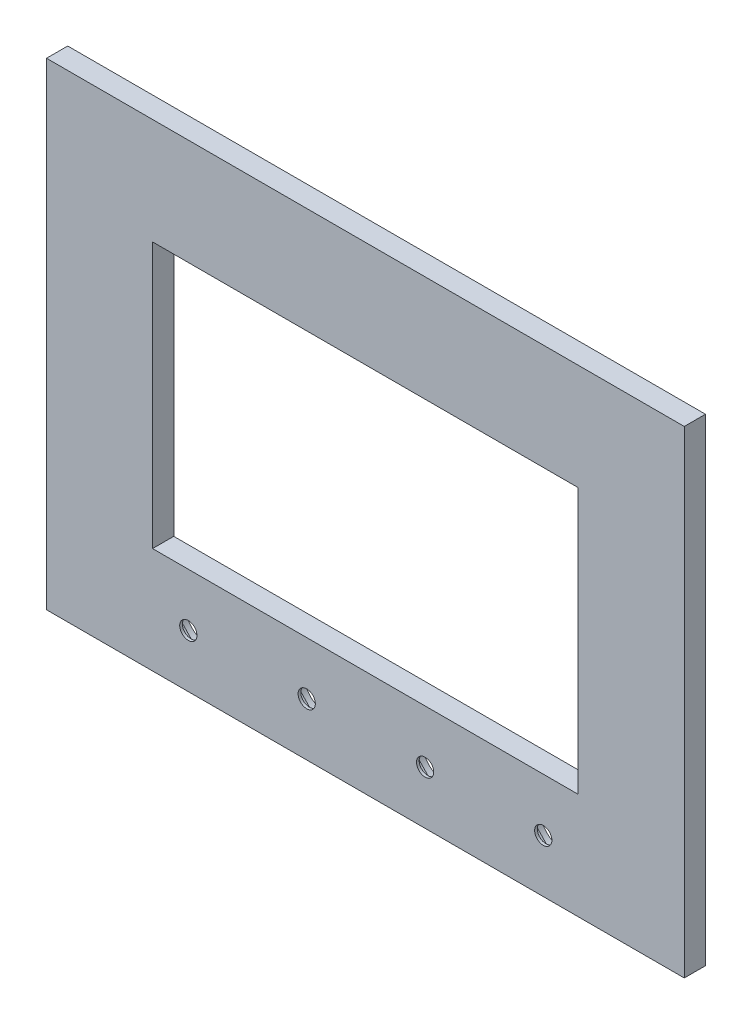
from build123d import *

# Parameters (mm, degrees)
SKETCH1_W                      = 240.6
SKETCH1_H                      = 180.2
BOSS_EXTRUDE1_DEPTH            = 8
SKETCH2_W                      = 160.6
SKETCH2_H                      = 100.2
CUT_EXTRUDE1_DEPTH             = 200.503872501
CUT_EXTRUDE2_DEPTH             = 7
CUT_EXTRUDE3_DEPTH             = 7
CUT_EXTRUDE4_DEPTH             = 7
CUT_EXTRUDE5_DEPTH             = 7
F_6_5_6_5_DIAMETER_HOLE1_D     = 6.5
F_6_5_6_5_DIAMETER_HOLE1_DEPTH = 8
SKETCH9_R                      = 9.267416037
SKETCH9_R_2                    = 9.269178346
SKETCH9_R_3                    = 9.266671768
CUT_EXTRUDE7_DEPTH             = 4


with BuildPart() as part:
    # Sketch1 → Boss-Extrude1 (new body)
    with BuildSketch(Plane(origin=(0, 0, 0), x_dir=(-1, 0, 0), z_dir=(0, 0, -1))):
        with Locations((-50.702318109, 12.34999924)):
            Rectangle(SKETCH1_W, SKETCH1_H)
    extrude(amount=-BOSS_EXTRUDE1_DEPTH)

    # Sketch2 → Cut-Extrude1 (cut, through all)
    with BuildSketch(Plane.XY.offset(8)):
        with Locations((50.702318109, 12.34999924)):
            Rectangle(SKETCH2_W, SKETCH2_H)
    extrude(amount=-CUT_EXTRUDE1_DEPTH, mode=Mode.SUBTRACT)

    # Sketch3 → Cut-Extrude2 (cut)
    with BuildSketch(Plane(origin=(0, 0, 0), x_dir=(-1, 0, 0), z_dir=(0, 0, -1))):
        Polygon((-117.686768689, -48.483328992), (-127.060792146, -58.198146757), (-117.921667286, -67.016672528), (-108.547643828, -57.301854763), align=None)
    extrude(amount=-CUT_EXTRUDE2_DEPTH, mode=Mode.SUBTRACT)

    # Sketch4 → Cut-Extrude3 (cut)
    with BuildSketch(Plane(origin=(0, 0, 0), x_dir=(-1, 0, 0), z_dir=(0, 0, -1))):
        Polygon((6.939207854, -58.198146757), (16.078332714, -67.016672528), (25.452356172, -57.301854763), (16.313231311, -48.483328992), align=None)
    extrude(amount=-CUT_EXTRUDE3_DEPTH, mode=Mode.SUBTRACT)

    # Sketch5 → Cut-Extrude4 (cut)
    with BuildSketch(Plane(origin=(0, 0, 0), x_dir=(-1, 0, 0), z_dir=(0, 0, -1))):
        Polygon((-37.727458813, -58.198146757), (-28.588333952, -67.016672528), (-19.214310494, -57.301854763), (-28.353435355, -48.483328992), align=None)
    extrude(amount=-CUT_EXTRUDE4_DEPTH, mode=Mode.SUBTRACT)

    # Sketch6 → Cut-Extrude5 (cut)
    with BuildSketch(Plane(origin=(0, 0, 0), x_dir=(-1, 0, 0), z_dir=(0, 0, -1))):
        Polygon((-82.39412548, -58.198146757), (-73.255000619, -67.016672528), (-63.880977161, -57.301854763), (-73.020102022, -48.483328992), align=None)
    extrude(amount=-CUT_EXTRUDE5_DEPTH, mode=Mode.SUBTRACT)

    # Ø6.5 (6.5) Diameter Hole1
    with Locations(Plane.XY.offset(8)):
        with Locations((117.804217987, -57.75000076), (-16.097681891, -57.75000076), (28.568984776, -57.75000076), (73.235651442, -57.75000076)):
            Hole(F_6_5_6_5_DIAMETER_HOLE1_D / 2, depth=F_6_5_6_5_DIAMETER_HOLE1_DEPTH)

    # Sketch9 → Cut-Extrude7 (cut)
    with BuildSketch(Plane(origin=(0, 0, 0), x_dir=(-1, 0, 0), z_dir=(0, 0, -1))):
        with Locations((-117.804217987, -57.75000076)):
            Circle(SKETCH9_R)
        with Locations((-73.235651442, -57.75000076)):
            Circle(SKETCH9_R_2)
        with Locations((-28.568984776, -57.75000076)):
            Circle(SKETCH9_R_2)
        with Locations((16.097681891, -57.75000076)):
            Circle(SKETCH9_R_3)
    extrude(amount=-CUT_EXTRUDE7_DEPTH, mode=Mode.SUBTRACT)


solid = part.part
